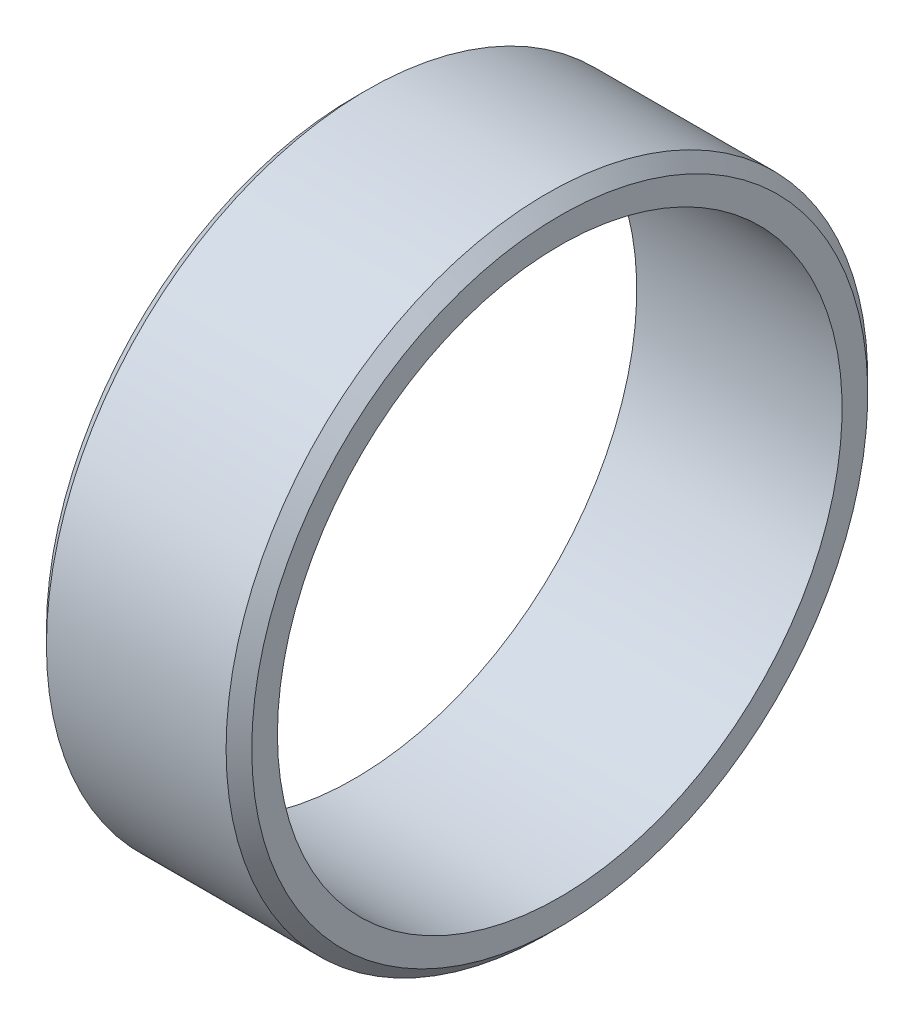
from build123d import *


with BuildPart() as part:
    # Esquisse1 → Base-Révolution (revolve)
    with BuildSketch(Plane.XY, mode=Mode.PRIVATE) as base_r_volution_sk:
        Polygon((0, 22), (16, 22), (16, 24), (15, 25), (1, 25), (0, 24), align=None)
    revolve(base_r_volution_sk.sketch.rotate(Axis((0, 0, 0), (1, 0, 0)), 90), axis=Axis((0, 0, 0), (1, 0, 0)))


solid = part.part
